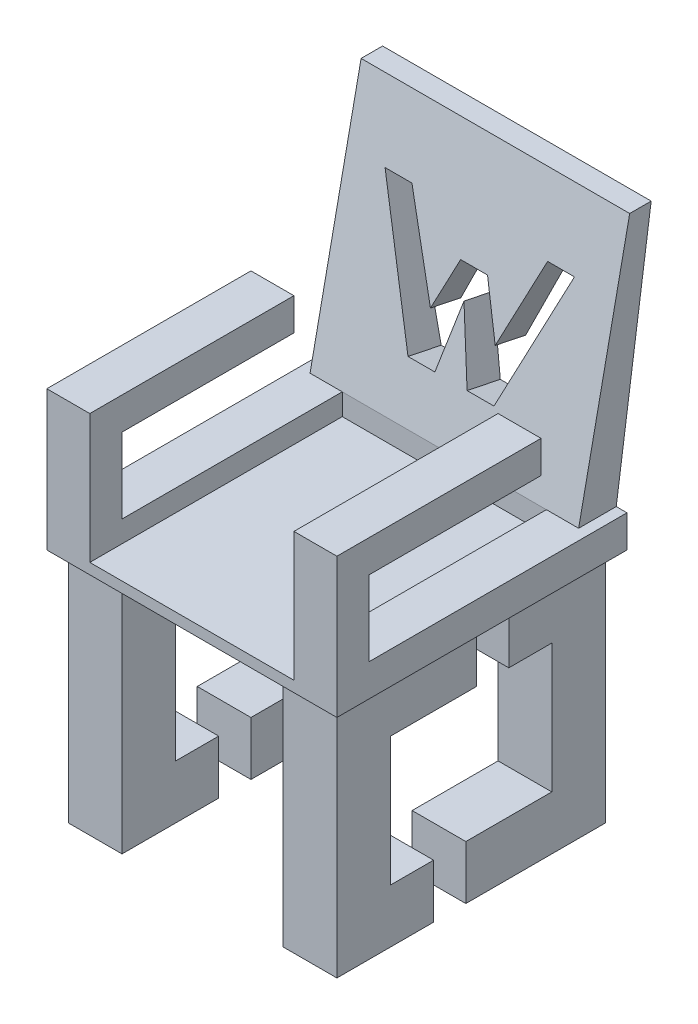
from build123d import *

# Parameters (mm, degrees)
BOSS_EXTRUDE1_DEPTH   = 127
BOSS_EXTRUDE1_2_DEPTH = 127
BOSS_EXTRUDE7_DEPTH   = 127
BOSS_EXTRUDE7_2_DEPTH = 127
SKETCH10_W            = 685.8
SKETCH10_H            = 685.8
BOSS_EXTRUDE8_DEPTH   = 76.2
SKETCH11_W            = 482.6
SKETCH11_H            = 596.9
CUT_EXTRUDE3_DEPTH    = 50.8
BOSS_EXTRUDE9_DEPTH   = 635
BOSS_EXTRUDE11_DEPTH  = 101.6
BOSS_EXTRUDE12_DEPTH  = 101.6
CUT_EXTRUDE4_DEPTH    = 1531.798988842


with BuildPart() as part:
    # Sketch1 → Boss-Extrude1 (new body)
    with BuildSketch(Plane(origin=(0, 0, 0), x_dir=(0, 0, -1), z_dir=(1, 0, 0))):
        Polygon((0, 0), (228.6, 0), (228.6, 127), (127, 127), (127, 431.8), (330.2, 431.8), (330.2, 558.8), (0, 558.8), align=None)
    extrude(amount=BOSS_EXTRUDE1_DEPTH)



with BuildPart() as body_2:
    # Sketch1 → Boss-Extrude1 2 (new body)
    with BuildSketch(Plane(origin=(0, 0, 0), x_dir=(0, 0, -1), z_dir=(1, 0, 0))):
        Polygon((635, 558.8), (635, 0), (304.8, 0), (304.8, 127), (508, 127), (508, 431.8), (406.4, 431.8), (406.4, 558.8), align=None)
    extrude(amount=BOSS_EXTRUDE1_2_DEPTH)


with BuildPart() as body_3:
    # Sketch9 → Boss-Extrude7 (new body)
    with BuildSketch(Plane(origin=(635, 0, 0), x_dir=(0, 0, -1), z_dir=(1, 0, 0))):
        Polygon((127, 431.8), (330.2, 431.8), (330.2, 558.8), (0, 558.8), (0, 0), (228.6, 0), (228.6, 127), (127, 127), align=None)
    extrude(amount=-BOSS_EXTRUDE7_DEPTH)


with BuildPart() as body_4:
    # Sketch9 → Boss-Extrude7 2 (new body)
    with BuildSketch(Plane(origin=(635, 0, 0), x_dir=(0, 0, -1), z_dir=(1, 0, 0))):
        Polygon((406.4, 558.8), (406.4, 431.8), (508, 431.8), (508, 127), (304.8, 127), (304.8, 0), (635, 0), (635, 558.8), align=None)
    extrude(amount=-BOSS_EXTRUDE7_2_DEPTH)


with BuildPart() as part_1:
    add(part.part)

    add(body_2.part)  # Boss-Extrude8 merges body 2

    add(body_3.part)  # Boss-Extrude8 merges body 3

    add(body_4.part)  # Boss-Extrude8 merges body 4
    # Sketch10 → Boss-Extrude8 (add)
    with BuildSketch(Plane(origin=(0, 558.8, 0), x_dir=(1, 0, 0), z_dir=(0, 1, 0))):
        with Locations((317.5, 317.5)):
            Rectangle(SKETCH10_W, SKETCH10_H)
    extrude(amount=BOSS_EXTRUDE8_DEPTH)

    # Sketch11 → Cut-Extrude3 (cut)
    with BuildSketch(Plane(origin=(0, 635, 0), x_dir=(1, 0, 0), z_dir=(0, 1, 0))):
        with Locations((317.5, 273.05)):
            Rectangle(SKETCH11_W, SKETCH11_H)
    extrude(amount=-CUT_EXTRUDE3_DEPTH, mode=Mode.SUBTRACT)

    # Sketch13 → Boss-Extrude9 (add)
    with BuildSketch(Plane(origin=(635, 0, 0), x_dir=(0, 0, -1), z_dir=(1, 0, 0))):
        Polygon((660.4, 635), (742.98211211, 1219.2), (692.18211211, 1219.2), (571.5, 635), align=None)
    extrude(amount=-BOSS_EXTRUDE9_DEPTH)

    # Sketch15 → Boss-Extrude11 (add)
    with BuildSketch(Plane(origin=(660.4, 0, 0), x_dir=(0, 0, -1), z_dir=(1, 0, 0))):
        Polygon((-25.4, 635), (-25.4, 889), (457.2, 889), (457.2, 812.8), (50.8, 812.8), (50.8, 635), align=None)
    extrude(amount=-BOSS_EXTRUDE11_DEPTH)

    # Sketch16 → Boss-Extrude12 (add)
    with BuildSketch(Plane(origin=(-25.4, 0, 0), x_dir=(0, 0, -1), z_dir=(1, 0, 0))):
        Polygon((50.8, 635), (50.8, 812.8), (457.2, 812.8), (457.2, 889), (-25.4, 889), (-25.4, 635), align=None)
    extrude(amount=BOSS_EXTRUDE12_DEPTH)

    # Sketch17 → Cut-Extrude4 (cut, through all)
    with BuildSketch(Plane(origin=(0, -87.23785604, -422.302482176), x_dir=(1, 0, 0), z_dir=(0, 0.20230522100715992, 0.9793225196804392))):
        Polygon((90.072307692, 1168.922071162), (153.572307692, 1168.922071162), (237.392307692, 970.802071162), (285.75, 1085.102071162), (349.25, 1085.102071162), (390.546160735, 970.802071162), (474.366160735, 1168.922071162), (537.866160735, 1168.922071162), (409.066806467, 864.487233803), (345.566806467, 864.487233803), (307.466806467, 1016.440282577), (269.366806467, 864.487233803), (205.866806467, 864.487233803), align=None)
    extrude(amount=-CUT_EXTRUDE4_DEPTH, mode=Mode.SUBTRACT)


solid = part_1.part
